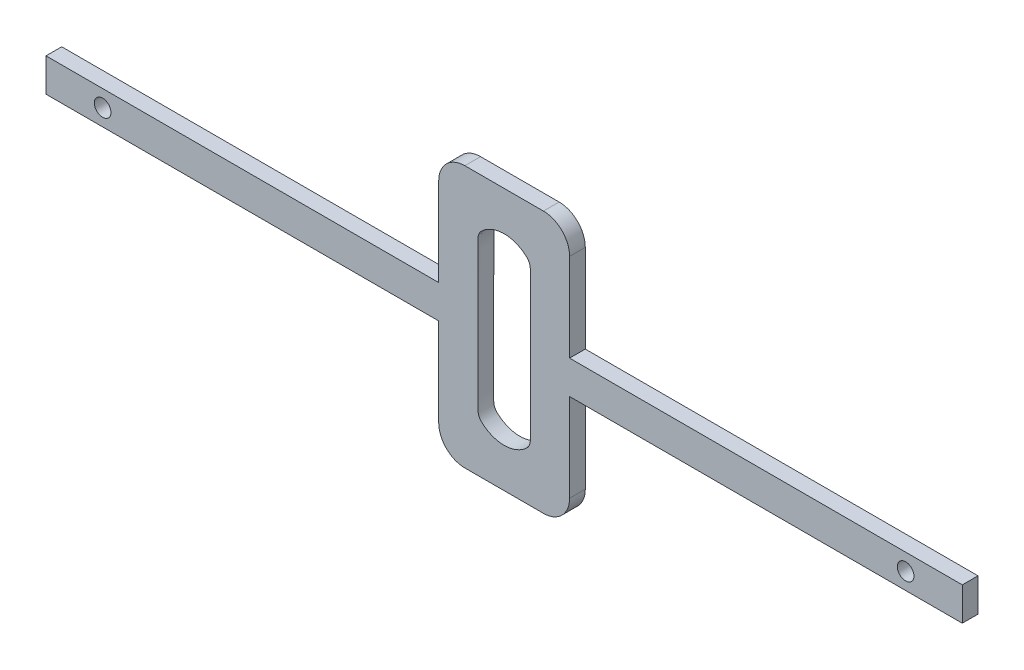
from build123d import *

# Parameters (mm, degrees)
SALIENTE_EXTRUIR1_DEPTH = 6
CROQUIS2_W              = 6
CROQUIS2_H              = 12.7
SALIENTE_EXTRUIR2_DEPTH = 150
CROQUIS3_R              = 3.175
CORTAR_EXTRUIR1_DEPTH   = 183.101620109


with BuildPart() as part:
    # Croquis1 → Saliente-Extruir1 (new body)
    with BuildSketch(Plane.XY):
        with BuildLine():
            Line((15, -50), (-15, -50))
            ThreePointArc((-15, -50), (-22.071067812, -47.071067812), (-25, -40))
            Line((-25, -40), (-25, 40))
            ThreePointArc((-25, 40), (-22.071067812, 47.071067812), (-15, 50))
            Line((-15, 50), (15, 50))
            ThreePointArc((15, 50), (22.071067812, 47.071067812), (25, 40))
            Line((25, 40), (25, -40))
            ThreePointArc((25, -40), (22.071067812, -47.071067812), (15, -50))
        make_face()
        with BuildLine():
            add(Edge.make_bspline(
                [(-10, -24.256176986), (-10, -8.085392329), (-10, 8.085392329), (-10, 24.256176986), (-10, 24.65467975), (-10, 25.451685278), (-10, 26.64719357), (-10, 27.444199098), (-10, 27.842701862), (-10, 28.364579862), (-10, 29.408335863), (-9.211361203, 31.09372065), (-8.410015728, 31.762504634), (-8.009342991, 32.096896626), (-7.762697374, 32.302741226), (-7.269406141, 32.714430424), (-6.441115692, 33.227173922), (-5.877510939, 33.53666939), (-5.590169944, 33.680339887), (-2.004468207, 35.473190756), (2.004468207, 35.473190756), (5.590169944, 33.680339887), (5.877510939, 33.53666939), (6.441115692, 33.227173922), (7.269406141, 32.714430424), (7.762697374, 32.302741226), (8.009342991, 32.096896626), (8.410015728, 31.762504634), (9.211361203, 31.09372065), (10, 29.408335863), (10, 28.364579862), (10, 27.842701862), (10, 27.444199098), (10, 26.64719357), (10, 25.451685278), (10, 24.65467975), (10, 24.256176986), (10, 8.085392329), (10, -8.085392329), (10, -24.256176986), (10, -24.65467975), (10, -25.451685278), (10, -26.64719357), (10, -27.444199098), (10, -27.842701862), (10, -28.364579862), (10, -29.408335863), (9.211361203, -31.09372065), (8.410015728, -31.762504634), (8.009342991, -32.096896626), (7.762697374, -32.302741226), (7.269406141, -32.714430424), (6.441115692, -33.227173922), (5.877510939, -33.53666939), (5.590169944, -33.680339887), (2.004468207, -35.473190756), (-2.004468207, -35.473190756), (-5.590169944, -33.680339887), (-5.877510939, -33.53666939), (-6.441115692, -33.227173922), (-7.269406141, -32.714430424), (-7.762697374, -32.302741226), (-8.009342991, -32.096896626), (-8.410015728, -31.762504634), (-9.211361203, -31.09372065), (-10, -29.408335863), (-10, -28.364579862), (-10, -27.842701862), (-10, -27.444199098), (-10, -26.64719357), (-10, -25.451685278), (-10, -24.65467975), (-10, -24.256176986)],
                knots=[0, 0, 0, 0, 0.295654977, 0.295654977, 0.295654977, 0.302940915, 0.310226852, 0.31751279, 0.31751279, 0.31751279, 0.327054431, 0.336596073, 0.346137714, 0.346137714, 0.346137714, 0.352011346, 0.357884977, 0.363758609, 0.363758609, 0.363758609, 0.431896369, 0.431896369, 0.431896369, 0.43777, 0.443643632, 0.449517263, 0.449517263, 0.449517263, 0.459058905, 0.468600546, 0.478142188, 0.478142188, 0.478142188, 0.485428125, 0.492714063, 0.5, 0.5, 0.5, 0.795654977, 0.795654977, 0.795654977, 0.802940915, 0.810226852, 0.81751279, 0.81751279, 0.81751279, 0.827054431, 0.836596073, 0.846137714, 0.846137714, 0.846137714, 0.852011346, 0.857884977, 0.863758609, 0.863758609, 0.863758609, 0.931896369, 0.931896369, 0.931896369, 0.93777, 0.943643632, 0.949517263, 0.949517263, 0.949517263, 0.959058905, 0.968600546, 0.978142188, 0.978142188, 0.978142188, 0.985428125, 0.992714063, 1, 1, 1, 1], degree=3, weights=[1, 1, 1, 1, 1, 1, 1, 1, 1, 1, 1, 1, 1, 1, 1, 1, 1, 1, 1, 0.929618127, 0.929618127, 1, 1, 1, 1, 1, 1, 1, 1, 1, 1, 1, 1, 1, 1, 1, 1, 1, 1, 1, 1, 1, 1, 1, 1, 1, 1, 1, 1, 1, 1, 1, 1, 1, 1, 0.929618127, 0.929618127, 1, 1, 1, 1, 1, 1, 1, 1, 1, 1, 1, 1, 1, 1, 1, 1]))
        make_face(mode=Mode.SUBTRACT)
    extrude(amount=SALIENTE_EXTRUIR1_DEPTH)

    # Croquis2 → Saliente-Extruir2 (add)
    with BuildSketch(Plane(origin=(25, 0, 0), x_dir=(0, 0, -1), z_dir=(1, 0, 0))):
        with Locations((-3, 0)):
            Rectangle(CROQUIS2_W, CROQUIS2_H)
    saliente_extruir2 = extrude(amount=SALIENTE_EXTRUIR2_DEPTH)

    # Simetría1: Saliente-Extruir2 across plane
    add(saliente_extruir2.mirror(Plane(origin=(0, 0, 0), x_dir=(0, 0, 1), z_dir=(1, 0, 0))))

    # Croquis3 → Cortar-Extruir1 (cut, through all)
    with BuildSketch(Plane.XY.offset(6)):
        with Locations((-153.359331414, 0)):
            Circle(CROQUIS3_R)
        with Locations(Location((153.359331414, 0, 0), (0, 0, 180))):
            Circle(CROQUIS3_R)
    extrude(amount=-CORTAR_EXTRUIR1_DEPTH, mode=Mode.SUBTRACT)


solid = part.part
